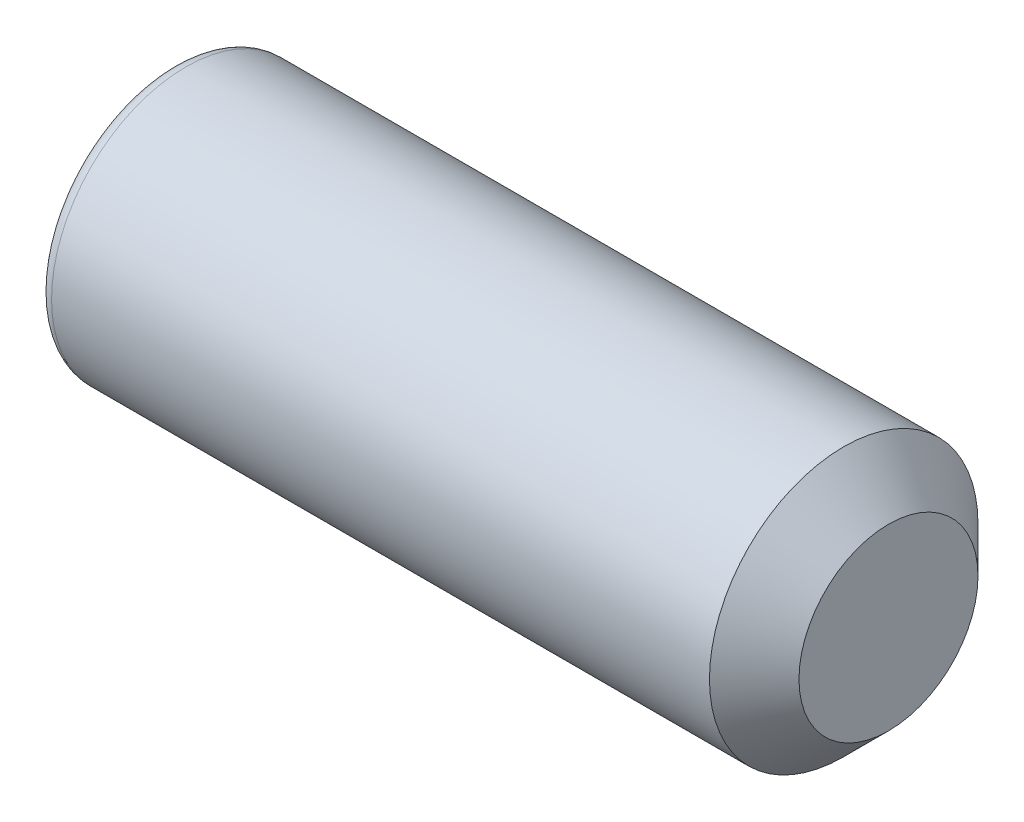
from build123d import *

# Parameters (mm, degrees)
CUT_EXTRUDE1_DEPTH = 1.2
FILLET1_R          = 0.15


with BuildPart() as part:
    # Sketch1 → Revolve1 (revolve)
    with BuildSketch(Plane.XY, mode=Mode.PRIVATE) as revolve1_sk:
        Polygon((0, 0), (0, 1.5), (7.5, 1.5), (8, 1), (8, 0), align=None)
    revolve(revolve1_sk.sketch.rotate(Axis((8, 0, 0), (-1, 0, 0)), 90), axis=Axis((8, 0, 0), (-1, 0, 0)))

    # Sketch2 → Cut-Extrude1 (cut)
    with BuildSketch(Plane.ZY):
        Polygon((0.433012702, 0.75), (-0.433012702, 0.75), (-0.866025404, 0), (-0.433012702, -0.75), (0.433012702, -0.75), (0.866025404, 0), align=None)
    extrude(amount=-CUT_EXTRUDE1_DEPTH, mode=Mode.SUBTRACT)

    # Fillet1
    fillet1_edges = [part.edges().sort_by_distance(p)[0] for p in [
        (0, 0, 1.5),
    ]]
    fillet(fillet1_edges, radius=FILLET1_R)


solid = part.part
